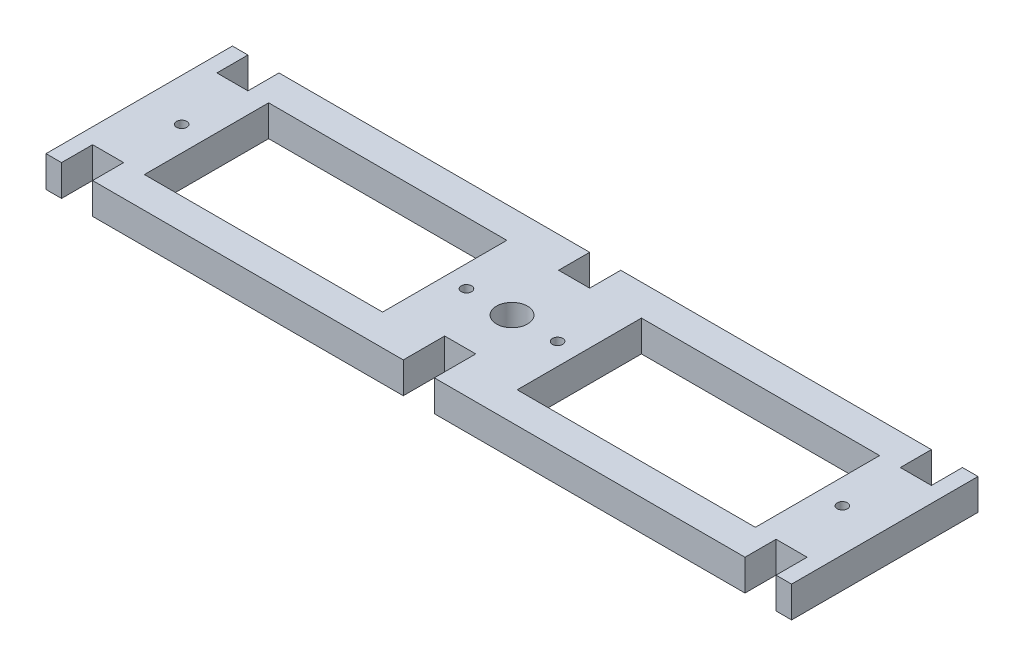
from build123d import *

# Parameters (mm, degrees)
SKETCH_1_R      = 1.5
SKETCH_1_R_2    = 0.5
SKETCH_1_W      = 23
SKETCH_1_H      = 12
EXTRUDE_1_DEPTH = 3


with BuildPart() as part:
    # 草图1 → 凸台-拉伸1 (new body)
    with BuildSketch(Plane(origin=(0, 0, 0), x_dir=(1, 0, 0), z_dir=(0, 1, 0))):
        Polygon((22.594315567, 25.84326654), (22.594315567, 28.84326654), (-7.405684433, 28.84326654), (-7.405684433, 25.84326654), (-10.405684433, 25.84326654), (-10.405684433, 28.84326654), (-40.405684433, 28.84326654), (-40.405684433, 25.84326654), (-43.405684433, 25.84326654), (-43.405684433, 28.84326654), (-44.905684433, 28.84326654), (-44.905684433, 10.84326654), (-43.405684433, 10.84326654), (-43.405684433, 13.84326654), (-40.405684433, 13.84326654), (-40.405684433, 10.84326654), (-10.405684433, 10.84326654), (-10.405684433, 14.84326654), (-7.405684433, 14.84326654), (-7.405684433, 10.84326654), (22.594315567, 10.84326654), (22.594315567, 13.84326654), (25.594315567, 13.84326654), (25.594315567, 10.84326654), (27.094315567, 10.84326654), (27.094315567, 28.84326654), (25.594315567, 28.84326654), (25.594315567, 25.84326654), align=None)
        with Locations(Location((-8.905684433, 19.84326654, 0), (0, 0, 270))):
            Circle(SKETCH_1_R, mode=Mode.SUBTRACT)
        with Locations(Location((-4.505684433, 19.84326654, 0), (0, 0, 270))):
            Circle(SKETCH_1_R_2, mode=Mode.SUBTRACT)
        with Locations(Location((-40.805684433, 19.84326654, 0), (0, 0, 270))):
            Circle(SKETCH_1_R_2, mode=Mode.SUBTRACT)
        with Locations(Location((-13.305684433, 19.84326654, 0), (0, 0, 270))):
            Circle(SKETCH_1_R_2, mode=Mode.SUBTRACT)
        with Locations(Location((22.994315567, 19.84326654, 0), (0, 0, 270))):
            Circle(SKETCH_1_R_2, mode=Mode.SUBTRACT)
        with Locations((9.094315567, 19.84326654)):
            Rectangle(SKETCH_1_W, SKETCH_1_H, mode=Mode.SUBTRACT)
        with Locations((-26.905684433, 19.84326654)):
            Rectangle(SKETCH_1_W, SKETCH_1_H, mode=Mode.SUBTRACT)
    extrude(amount=EXTRUDE_1_DEPTH)


solid = part.part
